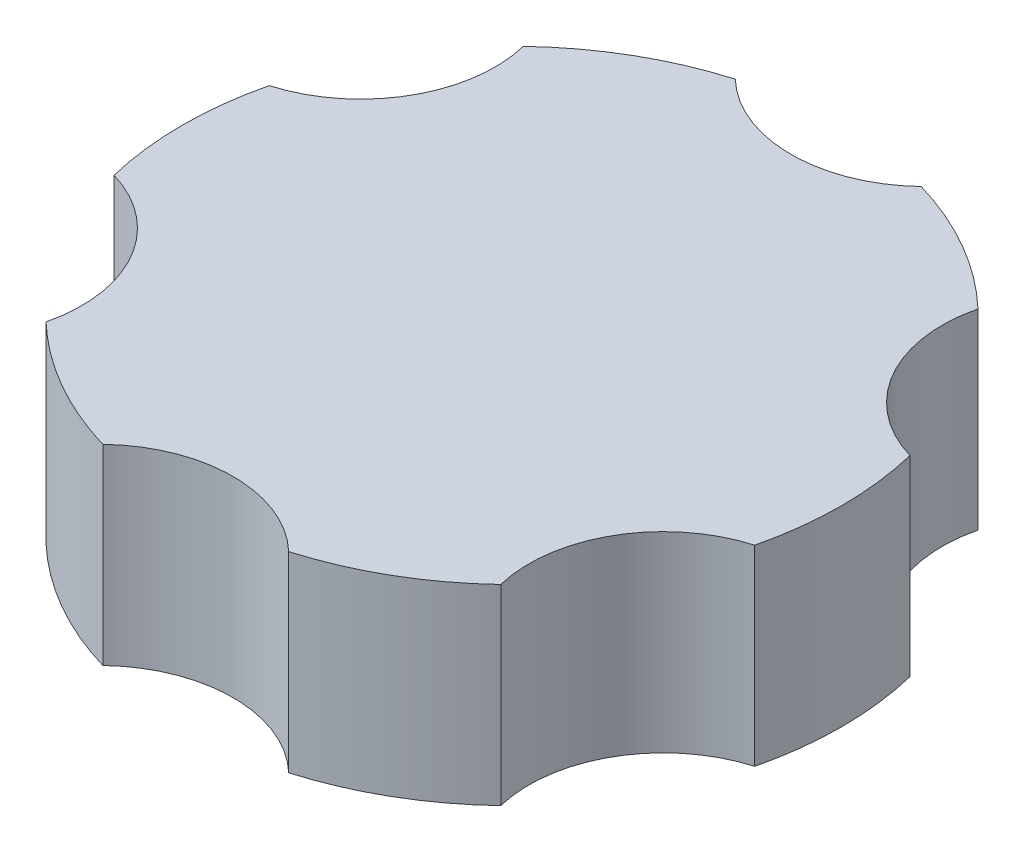
from build123d import *

# Parameters (mm, degrees)
SALIENTE_EXTRUIR1_DEPTH = 17


with BuildPart() as part:
    # Croquis1 → Saliente-Extruir1 (new body)
    with BuildSketch(Plane(origin=(0, 0, 0), x_dir=(1, 0, 0), z_dir=(0, 1, 0))):
        with BuildLine():
            ThreePointArc((8.25, -28.062430401), (14.625, -25.331243061), (20.177777619, -21.175924782))
            ThreePointArc((20.177777619, -21.175924782), (21.434128744, -12.375), (28.427777619, -6.886505619))
            ThreePointArc((28.427777619, -6.886505619), (29.25, 0), (28.427777619, 6.886505619))
            ThreePointArc((28.427777619, 6.886505619), (21.434128744, 12.375), (20.177777619, 21.175924782))
            ThreePointArc((20.177777619, 21.175924782), (14.625, 25.331243061), (8.25, 28.062430401))
            ThreePointArc((8.25, 28.062430401), (0, 24.75), (-8.25, 28.062430401))
            ThreePointArc((-8.25, 28.062430401), (-14.625, 25.331243061), (-20.177777619, 21.175924782))
            ThreePointArc((-20.177777619, 21.175924782), (-21.434128744, 12.375), (-28.427777619, 6.886505619))
            ThreePointArc((-28.427777619, 6.886505619), (-29.25, 0), (-28.427777619, -6.886505619))
            ThreePointArc((-28.427777619, -6.886505619), (-21.434128744, -12.375), (-20.177777619, -21.175924782))
            ThreePointArc((-20.177777619, -21.175924782), (-14.625, -25.331243061), (-8.25, -28.062430401))
            ThreePointArc((-8.25, -28.062430401), (0, -24.75), (8.25, -28.062430401))
        make_face()
    extrude(amount=SALIENTE_EXTRUIR1_DEPTH)


solid = part.part
